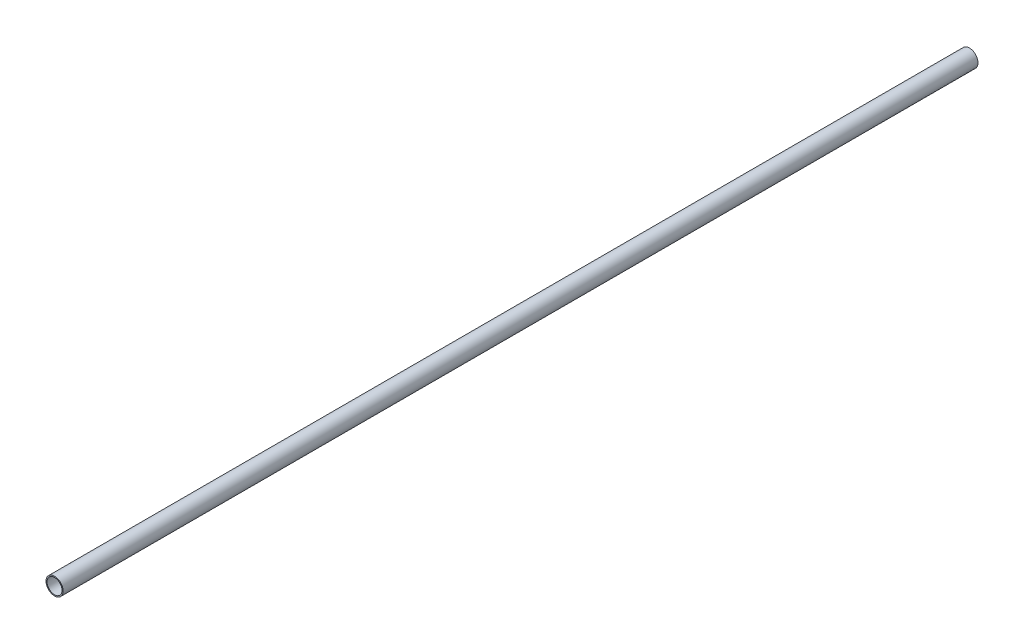
from build123d import *

# Parameters (mm, degrees)
SKETCH_1_R      = 4
SKETCH_1_R_2    = 3.5
EXTRUDE_1_DEPTH = 213.5


with BuildPart() as part:
    # Эскиз1 → Бобышка-Вытянуть1 (new, symmetric)
    with BuildSketch(Plane.XY):
        Circle(SKETCH_1_R)
        Circle(SKETCH_1_R_2, mode=Mode.SUBTRACT)
    extrude(amount=EXTRUDE_1_DEPTH, both=True)


solid = part.part
